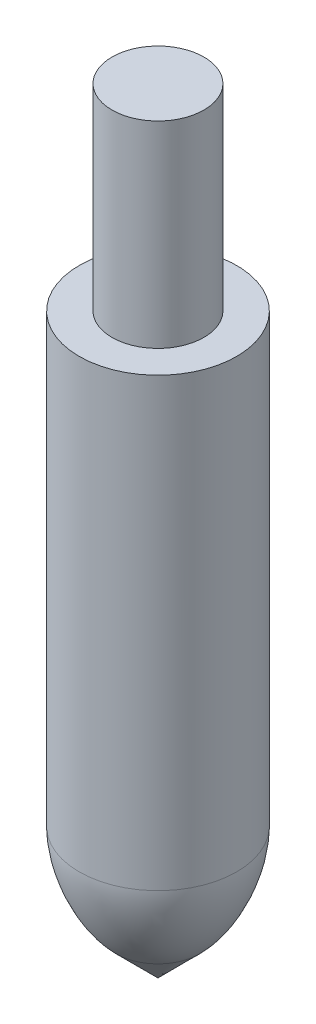
from build123d import *


with BuildPart() as part:
    # Sketch1 → Revolve1 (revolve)
    with BuildSketch(Plane.XY, mode=Mode.PRIVATE) as revolve1_sk:
        Polygon((0, 0), (0, 29.5), (1.75, 29.5), (1.75, 22), (3, 22), (3, 3), align=None)
    revolve(revolve1_sk.sketch.rotate(Axis((0, 40.591520335, 0), (0, -1, 0)), 90), axis=Axis((0, 40.591520335, 0), (0, -1, 0)))

    # Sketch2 → Cut-Revolve1 (revolve, cut)
    with BuildSketch(Plane.XY, mode=Mode.PRIVATE) as cut_revolve1_sk:
        with BuildLine():
            Line((3, 5), (3, 3))
            Line((3, 3), (1.585786438, 1.585786438))
            add(Edge.make_bspline(
                [(3, 5), (3, 3.894212959), (2.406543361, 2.406543361), (1.585786438, 1.585786438)],
                knots=[0, 0, 0, 0, 1, 1, 1, 1], degree=3))
        make_face()
    revolve(cut_revolve1_sk.sketch.rotate(Axis((0, 0, 0), (0, 1, 0)), 270), axis=Axis((0, 0, 0), (0, 1, 0)), mode=Mode.SUBTRACT)


solid = part.part
